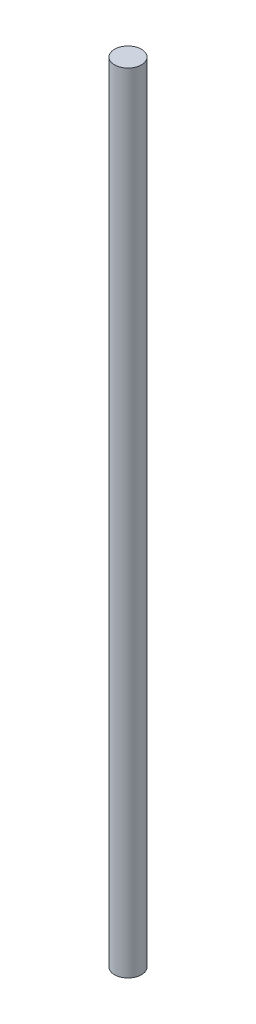
from build123d import *

# Parameters (mm, degrees)
SKETCH1_R           = 6
BOSS_EXTRUDE1_DEPTH = 350


with BuildPart() as part:
    # Sketch1 → Boss-Extrude1 (new body)
    with BuildSketch(Plane(origin=(0, 0, 0), x_dir=(1, 0, 0), z_dir=(0, 1, 0))):
        with Locations(Location((0, 0, 0), (0, 0, 270))):
            Circle(SKETCH1_R)
    extrude(amount=BOSS_EXTRUDE1_DEPTH)


solid = part.part
